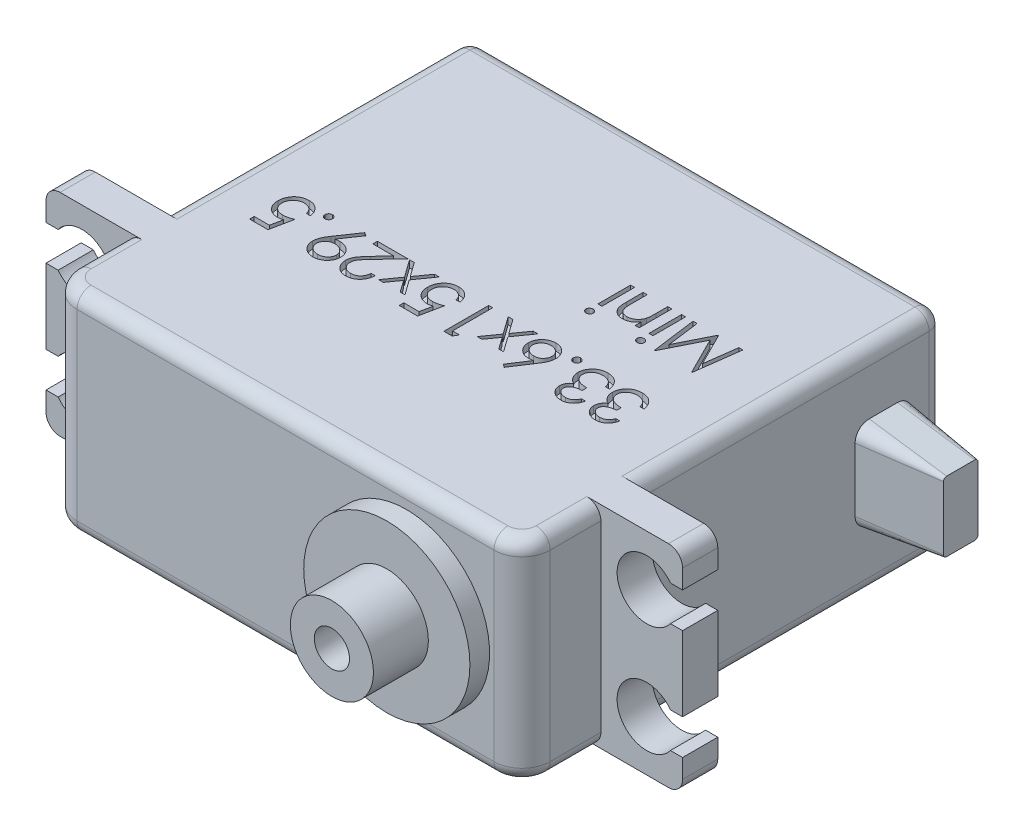
from build123d import *

# Parameters (mm, degrees)
SKETCH1_W                = 33.6
SKETCH1_H                = 15
BOSS_EXTRUDE1_DEPTH      = 14.95
BOSS_EXTRUDE2_DEPTH      = 7.5
BOSS_EXTRUDE2_DEPTH_BACK = 7.5
SKETCH2_W                = 45.2
SKETCH2_H                = 2.5
CUT_EXTRUDE2_DEPTH       = 10
SKETCH3_R                = 2.95
BOSS_EXTRUDE3_DEPTH      = 5.3
SKETCH4_W                = 0.284935897
SKETCH4_H                = 2.320192308
SKETCH4_W_2              = 0.284935898
CUT_EXTRUDE1_DEPTH       = 0.5
SKETCH7_R                = 5.9
BOSS_EXTRUDE4_DEPTH      = 1.4
FILLET1_R                = 2
BOSS_EXTRUDE5_DEPTH      = 5.5
BOSS_EXTRUDE5_TAPER      = 8
FILLET2_R                = 1
FILLET3_R                = 1
SKETCH9_R                = 1.25
CUT_EXTRUDE3_DEPTH       = 3


with BuildPart() as part:
    # Sketch1 → Boss-Extrude1 (new, symmetric)
    with BuildSketch(Plane.XY):
        Rectangle(SKETCH1_W, SKETCH1_H)
    extrude(amount=BOSS_EXTRUDE1_DEPTH, both=True)

    # Sketch2 → Boss-Extrude2 (add, two sides: drawn at the far end of the back side and taken through both)
    with BuildSketch(Plane(origin=(0, 0, 0), x_dir=(1, 0, 0), z_dir=(0, 1, 0)).offset(-BOSS_EXTRUDE2_DEPTH_BACK)):
        with Locations((0, -8.1)):
            Rectangle(SKETCH2_W, SKETCH2_H)
    extrude(amount=BOSS_EXTRUDE2_DEPTH + BOSS_EXTRUDE2_DEPTH_BACK)

    # Sketch6 → Cut-Extrude2 (cut)
    with BuildSketch(Plane.XY.offset(9.35)):
        with BuildLine():
            Line((-22.6, 5.15), (-21.737453703, 5.15))
            ThreePointArc((-21.737453703, 5.15), (-17.95, 3.9), (-21.737453703, 2.65))
            Line((-21.737453703, 2.65), (-22.6, 2.65))
            Line((-22.6, 2.65), (-22.6, 5.15))
        make_face()
        with BuildLine():
            Line((22.6, 2.65), (21.737453703, 2.65))
            ThreePointArc((21.737453703, 2.65), (17.95, 3.9), (21.737453703, 5.15))
            Line((21.737453703, 5.15), (22.6, 5.15))
            Line((22.6, 5.15), (22.6, 2.65))
        make_face()
        with BuildLine():
            Line((22.6, -2.65), (21.737453703, -2.65))
            ThreePointArc((21.737453703, -2.65), (17.95, -3.9), (21.737453703, -5.15))
            Line((21.737453703, -5.15), (22.6, -5.15))
            Line((22.6, -5.15), (22.6, -2.65))
        make_face()
        with BuildLine():
            Line((-22.6, -2.65), (-21.737453703, -2.65))
            ThreePointArc((-21.737453703, -2.65), (-17.95, -3.9), (-21.737453703, -5.15))
            Line((-21.737453703, -5.15), (-22.6, -5.15))
            Line((-22.6, -5.15), (-22.6, -2.65))
        make_face()
    extrude(amount=-CUT_EXTRUDE2_DEPTH, mode=Mode.SUBTRACT)

    # Sketch3 → Boss-Extrude3 (add)
    with BuildSketch(Plane.XY.offset(14.95)):
        with Locations(Location((8.6, 0, 0), (0, 0, 180))):
            Circle(SKETCH3_R)
    extrude(amount=BOSS_EXTRUDE3_DEPTH)

    # Sketch4 → Cut-Extrude1 (cut)
    # profile 1 of 18: a face of its own
    with BuildSketch(Plane.XZ.offset(-7.5)):
        with BuildLine():
            Line((12.047006277, 3.52944053), (12.331942175, 3.52944053))
            add(Edge.make_bspline(
                [(12.331942175, 3.52944053), (12.324222797, 3.561401426), (12.309132044, 3.623882364), (12.277656388, 3.713151808), (12.243367063, 3.797628145), (12.202192661, 3.875729584), (12.157281149, 3.949025731), (12.105825537, 4.015854151), (12.050199789, 4.077914484), (11.98867287, 4.132990064), (11.924149013, 4.182862718), (11.855719037, 4.225385092), (11.784759697, 4.261964859), (11.710779355, 4.292100355), (11.633557757, 4.31480208), (11.553793027, 4.331272896), (11.471276137, 4.341969122), (11.415262252, 4.343013028), (11.386819979, 4.343543094)],
                knots=[0, 0, 0, 0, 1.162005537, 2.271625781, 3.343758855, 4.383309926, 5.390229558, 6.379919256, 7.361854164, 8.333198761, 9.295911338, 10.242430842, 11.177959212, 12.116337295, 13.062827104, 14.020064771, 14.994644689, 16, 16, 16, 16], degree=3))
            add(Edge.make_bspline(
                [(11.386819979, 4.343543094), (11.345379206, 4.342291935), (11.263401603, 4.339816909), (11.142966553, 4.317215956), (11.026827939, 4.281451729), (10.916256978, 4.232036276), (10.813551686, 4.171087785), (10.722169574, 4.098548345), (10.643349282, 4.01581755), (10.577223668, 3.924438724), (10.52544849, 3.826779798), (10.487270137, 3.726268227), (10.464027612, 3.623142438), (10.461015393, 3.553512621), (10.459506277, 3.518628231)],
                knots=[0, 0, 0, 0, 1.083050992, 2.142477498, 3.193116406, 4.255571735, 5.30263384, 6.308962982, 7.297363603, 8.282367274, 9.249857812, 10.179914175, 11.08814088, 12, 12, 12, 12], degree=3))
            add(Edge.make_bspline(
                [(10.459506277, 3.518628231), (10.460561821, 3.485057781), (10.462627355, 3.419365621), (10.480165788, 3.32346112), (10.509680826, 3.233071954), (10.55056554, 3.147817614), (10.60348966, 3.068238652), (10.667599892, 2.994156023), (10.743348735, 2.925241144), (10.800751772, 2.885762764), (10.830304554, 2.865438126)],
                knots=[0, 0, 0, 0, 1.024540389, 2.004866551, 2.965041327, 3.920577974, 4.882998113, 5.874504559, 6.905732034, 8, 8, 8, 8], degree=3))
            add(Edge.make_bspline(
                [(10.830304554, 2.865438126), (10.796530034, 2.849129357), (10.729612941, 2.816816966), (10.638399246, 2.753447815), (10.555597174, 2.680280986), (10.509420229, 2.623183008), (10.486219018, 2.594494617)],
                knots=[0, 0, 0, 0, 1.015518401, 2.012035669, 3.001164323, 4, 4, 4, 4], degree=3))
            add(Edge.make_bspline(
                [(10.486219018, 2.594494617), (10.470941514, 2.573577942), (10.440636687, 2.532087118), (10.403230167, 2.465379074), (10.369294756, 2.397931652), (10.342851343, 2.327937048), (10.322373621, 2.256206528), (10.307735935, 2.182616926), (10.298642607, 2.107108149), (10.297340356, 2.056024684), (10.296685764, 2.030346981)],
                knots=[0, 0, 0, 0, 1.025084078, 2.033381695, 3.024893161, 4.013698104, 4.991890475, 5.976764909, 6.982997093, 8, 8, 8, 8], degree=3))
            add(Edge.make_bspline(
                [(10.296685764, 2.030346981), (10.298313644, 1.985888162), (10.301561744, 1.897179749), (10.330594011, 1.766120537), (10.375600308, 1.638008832), (10.439514814, 1.515476656), (10.517408912, 1.400831596), (10.610080199, 1.29825523), (10.716475726, 1.21008221), (10.835135136, 1.136412932), (10.963692817, 1.077523103), (11.101193533, 1.036649565), (11.245656082, 1.010028551), (11.344722702, 1.007173892), (11.395088208, 1.005722582)],
                knots=[0, 0, 0, 0, 0.955779014, 1.907060117, 2.875433937, 3.871313158, 4.872415639, 5.851225146, 6.836215519, 7.83643374, 8.849228613, 9.86973379, 10.916971861, 12, 12, 12, 12], degree=3))
            add(Edge.make_bspline(
                [(11.395088208, 1.005722582), (11.429032859, 1.006510175), (11.495824613, 1.008059896), (11.59401693, 1.018654056), (11.687744471, 1.038003418), (11.777133963, 1.064041416), (11.862264818, 1.097053925), (11.942877256, 1.138164458), (12.019467231, 1.186525607), (12.091311994, 1.242708218), (12.15840298, 1.305556291), (12.218957237, 1.376185536), (12.273984335, 1.453290324), (12.322010872, 1.537766239), (12.365224393, 1.628521579), (12.400767118, 1.726718431), (12.432050455, 1.831478937), (12.446595098, 1.904483744), (12.454057559, 1.94194053)],
                knots=[0, 0, 0, 0, 1.048658725, 2.063410685, 3.046034179, 4.001477787, 4.936774919, 5.862367409, 6.792675028, 7.730719943, 8.675894397, 9.627829632, 10.600096036, 11.597688215, 12.626045268, 13.701542398, 14.82072376, 16, 16, 16, 16], degree=3))
            Line((12.454057559, 1.94194053), (12.169121662, 1.94194053))
            add(Edge.make_bspline(
                [(12.169121662, 1.94194053), (12.161698247, 1.917493925), (12.147259062, 1.869943155), (12.122680663, 1.801508021), (12.09467873, 1.738771787), (12.064639095, 1.681274241), (12.033090076, 1.628449133), (11.99778868, 1.581693294), (11.961349527, 1.538953075), (11.933881827, 1.51487332), (11.920438769, 1.503088367)],
                knots=[0, 0, 0, 0, 1.198163088, 2.33053128, 3.407730985, 4.417276592, 5.372219308, 6.28897303, 7.162600585, 8, 8, 8, 8], degree=3))
            add(Edge.make_bspline(
                [(11.920438769, 1.503088367), (11.902661875, 1.48938295), (11.867162959, 1.462014421), (11.809316064, 1.427087943), (11.748478631, 1.396824728), (11.683332463, 1.373707375), (11.615283349, 1.354133354), (11.543231382, 1.341324026), (11.467812235, 1.332535471), (11.416315764, 1.331759926), (11.390000067, 1.331363607)],
                knots=[0, 0, 0, 0, 0.946170439, 1.889420265, 2.845303464, 3.807233317, 4.801018734, 5.828864929, 6.890507805, 8, 8, 8, 8], degree=3))
            add(Edge.make_bspline(
                [(11.390000067, 1.331363607), (11.360287961, 1.331922321), (11.302188503, 1.333014838), (11.217411595, 1.343062087), (11.136759839, 1.357694676), (11.061128685, 1.38029431), (10.989527439, 1.40821694), (10.9229598, 1.443276565), (10.860551903, 1.484410705), (10.803103085, 1.531164085), (10.751445375, 1.582346441), (10.705961674, 1.635879727), (10.667295017, 1.69153823), (10.636104199, 1.749629953), (10.611474771, 1.80991434), (10.594707868, 1.872560563), (10.583049708, 1.937055941), (10.582100281, 1.98089722), (10.581621662, 2.002998223)],
                knots=[0, 0, 0, 0, 1.217147791, 2.380027433, 3.494444702, 4.572153297, 5.609568379, 6.639424714, 7.649109417, 8.668170816, 9.669597737, 10.625200337, 11.543417969, 12.441394052, 13.322311151, 14.205496177, 15.095365482, 16, 16, 16, 16], degree=3))
            add(Edge.make_bspline(
                [(10.581621662, 2.002998223), (10.583009864, 2.032581366), (10.585779361, 2.09160045), (10.606923572, 2.178429964), (10.641702399, 2.262089774), (10.690391034, 2.341152526), (10.749659874, 2.414427808), (10.818933753, 2.479806939), (10.898787932, 2.533754807), (10.972284527, 2.571028089), (11.037385777, 2.596461721), (11.093098304, 2.613402582), (11.155470366, 2.627747826), (11.223747696, 2.641093958), (11.298444757, 2.65245261), (11.379480226, 2.661924829), (11.466870524, 2.669504044), (11.527368938, 2.672888681), (11.558544739, 2.674632838)],
                knots=[0, 0, 0, 0, 1.07054697, 2.135767047, 3.216561865, 4.33974944, 5.486079747, 6.621378074, 7.775625952, 8.963672916, 9.598146892, 10.304877434, 11.070270905, 11.915000392, 12.823868403, 13.805723172, 14.86925407, 16, 16, 16, 16], degree=3))
            Line((11.558544739, 2.674632838), (11.558544739, 3.000273864))
            add(Edge.make_bspline(
                [(11.558544739, 3.000273864), (11.519264396, 3.000940436), (11.442323853, 3.002246086), (11.329934019, 3.018037639), (11.2224618, 3.039882208), (11.12228897, 3.073342347), (11.030986208, 3.112204616), (10.951774855, 3.157427692), (10.885764657, 3.207696786), (10.8332764, 3.263787796), (10.793789171, 3.323945018), (10.764917719, 3.3866437), (10.747863137, 3.452433384), (10.745586511, 3.497332118), (10.744442175, 3.519900266)],
                knots=[0, 0, 0, 0, 1.321986639, 2.589447074, 3.816329219, 5.01088745, 6.139805852, 7.153945165, 8.075214402, 8.924034688, 9.728124013, 10.488707548, 11.240355623, 12, 12, 12, 12], degree=3))
            add(Edge.make_bspline(
                [(10.744442175, 3.519900266), (10.744818105, 3.536480792), (10.745565999, 3.569466962), (10.754997816, 3.617658988), (10.769171053, 3.664377704), (10.788656236, 3.709424431), (10.814736773, 3.752486751), (10.845947918, 3.793931794), (10.883111838, 3.833522937), (10.925698065, 3.870425798), (10.971428773, 3.905595035), (11.021548212, 3.935452405), (11.074545199, 3.960983997), (11.130478407, 3.982038331), (11.189529352, 3.9978764), (11.251420587, 4.009248199), (11.316270128, 4.016358071), (11.360513056, 4.017381706), (11.383003873, 4.017902069)],
                knots=[0, 0, 0, 0, 0.884392785, 1.759457502, 2.611959086, 3.489218968, 4.37281399, 5.2945488, 6.255912374, 7.266815255, 8.301784654, 9.332968512, 10.37626691, 11.440494194, 12.520033166, 13.637162961, 14.798855837, 16, 16, 16, 16], degree=3))
            add(Edge.make_bspline(
                [(11.383003873, 4.017902069), (11.419155029, 4.016639905), (11.489766645, 4.014174605), (11.591561605, 3.992581871), (11.686194144, 3.958130324), (11.758528506, 3.917006799), (11.811943412, 3.876411763), (11.850113206, 3.840958455), (11.887596812, 3.801558679), (11.921928248, 3.755785724), (11.956648212, 3.706739422), (11.988257207, 3.651926511), (12.018972785, 3.59277681), (12.037480812, 3.550961485), (12.047006277, 3.52944053)],
                knots=[0, 0, 0, 0, 1.472543308, 2.876219568, 4.221790263, 5.565193594, 6.249813518, 6.953379497, 7.687249741, 8.463570142, 9.283606569, 10.136032583, 11.040678096, 12, 12, 12, 12], degree=3))
        make_face()
    # profile 2 of 18: a face of its own
    with BuildSketch(Plane.XZ.offset(-7.5)):
        with BuildLine():
            Line((9.604698585, 3.52944053), (9.889634482, 3.52944053))
            add(Edge.make_bspline(
                [(9.889634482, 3.52944053), (9.881915104, 3.561401426), (9.866824351, 3.623882364), (9.835348695, 3.713151808), (9.801059371, 3.797628145), (9.759884969, 3.875729584), (9.714973456, 3.949025731), (9.663517845, 4.015854151), (9.607892096, 4.077914484), (9.546365178, 4.132990064), (9.481841321, 4.182862718), (9.413411344, 4.225385092), (9.342452005, 4.261964859), (9.268471663, 4.292100355), (9.191250064, 4.31480208), (9.111485335, 4.331272896), (9.028968445, 4.341969122), (8.972954559, 4.343013028), (8.944512287, 4.343543094)],
                knots=[0, 0, 0, 0, 1.162005537, 2.271625781, 3.343758855, 4.383309926, 5.390229558, 6.379919256, 7.361854164, 8.333198761, 9.295911338, 10.242430842, 11.177959212, 12.116337295, 13.062827104, 14.020064771, 14.994644689, 16, 16, 16, 16], degree=3))
            add(Edge.make_bspline(
                [(8.944512287, 4.343543094), (8.903071514, 4.342291935), (8.821093911, 4.339816909), (8.700658861, 4.317215956), (8.584520247, 4.281451729), (8.473949286, 4.232036276), (8.371243994, 4.171087785), (8.279861881, 4.098548345), (8.20104159, 4.01581755), (8.134915975, 3.924438724), (8.083140798, 3.826779798), (8.044962445, 3.726268227), (8.02171992, 3.623142438), (8.0187077, 3.553512621), (8.017198585, 3.518628231)],
                knots=[0, 0, 0, 0, 1.083050992, 2.142477498, 3.193116406, 4.255571735, 5.30263384, 6.308962982, 7.297363603, 8.282367274, 9.249857812, 10.179914175, 11.08814088, 12, 12, 12, 12], degree=3))
            add(Edge.make_bspline(
                [(8.017198585, 3.518628231), (8.018254128, 3.485057781), (8.020319663, 3.419365621), (8.037858096, 3.32346112), (8.067373134, 3.233071954), (8.108257847, 3.147817614), (8.161181968, 3.068238652), (8.2252922, 2.994156023), (8.301041043, 2.925241144), (8.35844408, 2.885762764), (8.387996862, 2.865438126)],
                knots=[0, 0, 0, 0, 1.024540389, 2.004866551, 2.965041327, 3.920577974, 4.882998113, 5.874504559, 6.905732034, 8, 8, 8, 8], degree=3))
            add(Edge.make_bspline(
                [(8.387996862, 2.865438126), (8.354222342, 2.849129357), (8.287305249, 2.816816966), (8.196091554, 2.753447815), (8.113289482, 2.680280986), (8.067112536, 2.623183008), (8.043911325, 2.594494617)],
                knots=[0, 0, 0, 0, 1.015518401, 2.012035669, 3.001164323, 4, 4, 4, 4], degree=3))
            add(Edge.make_bspline(
                [(8.043911325, 2.594494617), (8.028633822, 2.573577942), (7.998328995, 2.532087118), (7.960922475, 2.465379074), (7.926987064, 2.397931652), (7.900543651, 2.327937048), (7.880065929, 2.256206528), (7.865428242, 2.182616926), (7.856334914, 2.107108149), (7.855032664, 2.056024684), (7.854378072, 2.030346981)],
                knots=[0, 0, 0, 0, 1.025084078, 2.033381695, 3.024893161, 4.013698104, 4.991890475, 5.976764909, 6.982997093, 8, 8, 8, 8], degree=3))
            add(Edge.make_bspline(
                [(7.854378072, 2.030346981), (7.856005952, 1.985888162), (7.859254052, 1.897179749), (7.888286319, 1.766120537), (7.933292616, 1.638008832), (7.997207122, 1.515476656), (8.075101219, 1.400831596), (8.167772506, 1.29825523), (8.274168034, 1.21008221), (8.392827444, 1.136412932), (8.521385125, 1.077523103), (8.65888584, 1.036649565), (8.803348389, 1.010028551), (8.902415009, 1.007173892), (8.952780516, 1.005722582)],
                knots=[0, 0, 0, 0, 0.955779014, 1.907060117, 2.875433937, 3.871313158, 4.872415639, 5.851225146, 6.836215519, 7.83643374, 8.849228613, 9.86973379, 10.916971861, 12, 12, 12, 12], degree=3))
            add(Edge.make_bspline(
                [(8.952780516, 1.005722582), (8.986725167, 1.006510175), (9.053516921, 1.008059896), (9.151709237, 1.018654056), (9.245436779, 1.038003418), (9.334826271, 1.064041416), (9.419957126, 1.097053925), (9.500569564, 1.138164458), (9.577159539, 1.186525607), (9.649004302, 1.242708218), (9.716095288, 1.305556291), (9.776649545, 1.376185536), (9.831676643, 1.453290324), (9.879703179, 1.537766239), (9.922916701, 1.628521579), (9.958459426, 1.726718431), (9.989742763, 1.831478937), (10.004287405, 1.904483744), (10.011749867, 1.94194053)],
                knots=[0, 0, 0, 0, 1.048658725, 2.063410685, 3.046034179, 4.001477787, 4.936774919, 5.862367409, 6.792675028, 7.730719943, 8.675894397, 9.627829632, 10.600096036, 11.597688215, 12.626045268, 13.701542398, 14.82072376, 16, 16, 16, 16], degree=3))
            Line((10.011749867, 1.94194053), (9.72681397, 1.94194053))
            add(Edge.make_bspline(
                [(9.72681397, 1.94194053), (9.719390555, 1.917493925), (9.704951369, 1.869943155), (9.68037297, 1.801508021), (9.652371038, 1.738771787), (9.622331403, 1.681274241), (9.590782384, 1.628449133), (9.555480987, 1.581693294), (9.519041834, 1.538953075), (9.491574135, 1.51487332), (9.478131077, 1.503088367)],
                knots=[0, 0, 0, 0, 1.198163088, 2.33053128, 3.407730985, 4.417276592, 5.372219308, 6.28897303, 7.162600585, 8, 8, 8, 8], degree=3))
            add(Edge.make_bspline(
                [(9.478131077, 1.503088367), (9.460354182, 1.48938295), (9.424855267, 1.462014421), (9.367008371, 1.427087943), (9.306170939, 1.396824728), (9.24102477, 1.373707375), (9.172975657, 1.354133354), (9.10092369, 1.341324026), (9.025504543, 1.332535471), (8.974008072, 1.331759926), (8.947692375, 1.331363607)],
                knots=[0, 0, 0, 0, 0.946170439, 1.889420265, 2.845303464, 3.807233317, 4.801018734, 5.828864929, 6.890507805, 8, 8, 8, 8], degree=3))
            add(Edge.make_bspline(
                [(8.947692375, 1.331363607), (8.917980269, 1.331922321), (8.859880811, 1.333014838), (8.775103903, 1.343062087), (8.694452147, 1.357694676), (8.618820992, 1.38029431), (8.547219747, 1.40821694), (8.480652107, 1.443276565), (8.418244211, 1.484410705), (8.360795393, 1.531164085), (8.309137683, 1.582346441), (8.263653981, 1.635879727), (8.224987324, 1.69153823), (8.193796507, 1.749629953), (8.169167079, 1.80991434), (8.152400176, 1.872560563), (8.140742016, 1.937055941), (8.139792589, 1.98089722), (8.13931397, 2.002998223)],
                knots=[0, 0, 0, 0, 1.217147791, 2.380027433, 3.494444702, 4.572153297, 5.609568379, 6.639424714, 7.649109417, 8.668170816, 9.669597737, 10.625200337, 11.543417969, 12.441394052, 13.322311151, 14.205496177, 15.095365482, 16, 16, 16, 16], degree=3))
            add(Edge.make_bspline(
                [(8.13931397, 2.002998223), (8.140702172, 2.032581366), (8.143471668, 2.09160045), (8.16461588, 2.178429964), (8.199394706, 2.262089774), (8.248083342, 2.341152526), (8.307352181, 2.414427808), (8.376626061, 2.479806939), (8.45648024, 2.533754807), (8.529976835, 2.571028089), (8.595078084, 2.596461721), (8.650790612, 2.613402582), (8.713162673, 2.627747826), (8.781440004, 2.641093958), (8.856137065, 2.65245261), (8.937172533, 2.661924829), (9.024562831, 2.669504044), (9.085061246, 2.672888681), (9.116237046, 2.674632838)],
                knots=[0, 0, 0, 0, 1.07054697, 2.135767047, 3.216561865, 4.33974944, 5.486079747, 6.621378074, 7.775625952, 8.963672916, 9.598146892, 10.304877434, 11.070270905, 11.915000392, 12.823868403, 13.805723172, 14.86925407, 16, 16, 16, 16], degree=3))
            Line((9.116237046, 2.674632838), (9.116237046, 3.000273864))
            add(Edge.make_bspline(
                [(9.116237046, 3.000273864), (9.076956703, 3.000940436), (9.00001616, 3.002246086), (8.887626327, 3.018037639), (8.780154108, 3.039882208), (8.679981278, 3.073342347), (8.588678516, 3.112204616), (8.509467163, 3.157427692), (8.443456965, 3.207696786), (8.390968707, 3.263787796), (8.351481478, 3.323945018), (8.322610026, 3.3866437), (8.305555445, 3.452433384), (8.303278818, 3.497332118), (8.302134482, 3.519900266)],
                knots=[0, 0, 0, 0, 1.321986639, 2.589447074, 3.816329219, 5.01088745, 6.139805852, 7.153945165, 8.075214402, 8.924034688, 9.728124013, 10.488707548, 11.240355623, 12, 12, 12, 12], degree=3))
            add(Edge.make_bspline(
                [(8.302134482, 3.519900266), (8.302510412, 3.536480792), (8.303258307, 3.569466962), (8.312690123, 3.617658988), (8.326863361, 3.664377704), (8.346348544, 3.709424431), (8.372429081, 3.752486751), (8.403640226, 3.793931794), (8.440804145, 3.833522937), (8.483390372, 3.870425798), (8.529121081, 3.905595035), (8.57924052, 3.935452405), (8.632237506, 3.960983997), (8.688170715, 3.982038331), (8.74722166, 3.9978764), (8.809112894, 4.009248199), (8.873962436, 4.016358071), (8.918205364, 4.017381706), (8.940696181, 4.017902069)],
                knots=[0, 0, 0, 0, 0.884392785, 1.759457502, 2.611959086, 3.489218968, 4.37281399, 5.2945488, 6.255912374, 7.266815255, 8.301784654, 9.332968512, 10.37626691, 11.440494194, 12.520033166, 13.637162961, 14.798855837, 16, 16, 16, 16], degree=3))
            add(Edge.make_bspline(
                [(8.940696181, 4.017902069), (8.976847337, 4.016639905), (9.047458953, 4.014174605), (9.149253913, 3.992581871), (9.243886452, 3.958130324), (9.316220814, 3.917006799), (9.36963572, 3.876411763), (9.407805514, 3.840958455), (9.44528912, 3.801558679), (9.479620555, 3.755785724), (9.51434052, 3.706739422), (9.545949515, 3.651926511), (9.576665093, 3.59277681), (9.59517312, 3.550961485), (9.604698585, 3.52944053)],
                knots=[0, 0, 0, 0, 1.472543308, 2.876219568, 4.221790263, 5.565193594, 6.249813518, 6.953379497, 7.687249741, 8.463570142, 9.283606569, 10.136032583, 11.040678096, 12, 12, 12, 12], degree=3))
        make_face()
    # profile 3 of 18: a face of its own
    with BuildSketch(Plane.XZ.offset(-7.5)):
        with BuildLine():
            add(Edge.make_bspline(
                [(7.060628072, 1.575594376), (7.042947665, 1.574543754), (7.008287295, 1.572484131), (6.958177514, 1.558353863), (6.912825216, 1.533263506), (6.872428108, 1.4998237), (6.83913009, 1.459278349), (6.813145571, 1.414287774), (6.799138391, 1.363758472), (6.797093771, 1.328897267), (6.796044739, 1.311011043)],
                knots=[0, 0, 0, 0, 1.020151414, 1.999887582, 2.974338812, 3.990962822, 5.007586832, 5.987933904, 6.967670073, 8, 8, 8, 8], degree=3))
            add(Edge.make_bspline(
                [(6.796044739, 1.311011043), (6.797129319, 1.293554594), (6.799268097, 1.259130733), (6.813113463, 1.208982549), (6.839328122, 1.163963857), (6.872198437, 1.122868346), (6.912835202, 1.089357699), (6.958284734, 1.064480808), (7.008169661, 1.049338797), (7.04292804, 1.047409942), (7.060628072, 1.04642771)],
                knots=[0, 0, 0, 0, 1.009421747, 1.99056486, 2.972319754, 3.999869655, 5.017953583, 5.993804169, 6.978383603, 8, 8, 8, 8], degree=3))
            add(Edge.make_bspline(
                [(7.060628072, 1.04642771), (7.078340858, 1.047374401), (7.112920856, 1.049222592), (7.162619579, 1.064791709), (7.208345901, 1.089124419), (7.248974753, 1.12293083), (7.282120367, 1.163752389), (7.307180536, 1.20929259), (7.322230171, 1.258987179), (7.324209441, 1.29352632), (7.325211405, 1.311011043)],
                knots=[0, 0, 0, 0, 1.022052826, 1.995314843, 2.982371812, 4.00089066, 5.028879526, 6.005146991, 6.990147033, 8, 8, 8, 8], degree=3))
            add(Edge.make_bspline(
                [(7.325211405, 1.311011043), (7.32424793, 1.328926552), (7.322366861, 1.363904384), (7.307148941, 1.41397786), (7.282314806, 1.459487801), (7.248745626, 1.499761842), (7.208355729, 1.533496038), (7.162729886, 1.558047671), (7.11280116, 1.572598617), (7.078320716, 1.574578471), (7.060628072, 1.575594376)],
                knots=[0, 0, 0, 0, 1.032775665, 2.016367738, 2.991239715, 4.008302682, 5.025365648, 6.011011707, 6.979408107, 8, 8, 8, 8], degree=3))
        make_face()
    # profile 4 of 18: a face of its own
    with BuildSketch(Plane.XZ.offset(-7.5)):
        with BuildLine():
            Line((4.923608841, 4.343543094), (4.70418276, 4.171182317))
            Line((4.70418276, 4.171182317), (5.543090011, 2.888334761))
            add(Edge.make_bspline(
                [(5.543090011, 2.888334761), (5.487236974, 2.897237335), (5.37828931, 2.914602811), (5.268011674, 2.917467519), (5.214268897, 2.918863607)],
                knots=[0, 0, 0, 0, 1.025318673, 2, 2, 2, 2], degree=3))
            add(Edge.make_bspline(
                [(5.214268897, 2.918863607), (5.181999561, 2.917996277), (5.118478334, 2.916288964), (5.025217878, 2.903150042), (4.9356022, 2.882444405), (4.850002737, 2.852261716), (4.768112247, 2.813706009), (4.689460787, 2.767497176), (4.615526821, 2.711249166), (4.545358251, 2.648415957), (4.481652242, 2.578822692), (4.425249677, 2.504980051), (4.377872516, 2.426964966), (4.339433316, 2.344816952), (4.30958389, 2.258662638), (4.287823669, 2.168612254), (4.274960753, 2.074603705), (4.273214058, 2.010669932), (4.27232679, 1.978193535)],
                knots=[0, 0, 0, 0, 1.04369286, 2.054478336, 3.041073146, 4.015093852, 4.984733326, 5.965804835, 6.960378782, 7.985147595, 9.009457201, 10.008161701, 10.986880575, 11.956520048, 12.937015923, 13.931873656, 14.949455224, 16, 16, 16, 16], degree=3))
            add(Edge.make_bspline(
                [(4.27232679, 1.978193535), (4.273617749, 1.933761946), (4.276158052, 1.846331095), (4.301470781, 1.718989369), (4.340804173, 1.597674872), (4.397026646, 1.484324496), (4.466860664, 1.379093593), (4.552021052, 1.285852492), (4.649487645, 1.202694673), (4.759693526, 1.133156168), (4.878296072, 1.076366258), (5.002893956, 1.03557636), (5.132277153, 1.010463498), (5.220092761, 1.007315166), (5.26451429, 1.005722582)],
                knots=[0, 0, 0, 0, 1.031375318, 2.029502543, 3.004789286, 3.987476834, 4.960371455, 5.9300674, 6.912260825, 7.929083631, 8.949397511, 9.960523116, 10.96833055, 12, 12, 12, 12], degree=3))
            add(Edge.make_bspline(
                [(5.26451429, 1.005722582), (5.307237726, 1.007108882), (5.391865371, 1.009854902), (5.51635512, 1.03431686), (5.635973715, 1.073965446), (5.749883082, 1.128588399), (5.855402495, 1.197583764), (5.949804893, 1.280643831), (6.032619575, 1.375993132), (6.101539409, 1.483616875), (6.156202688, 1.59926848), (6.197196405, 1.719861472), (6.221141569, 1.844956455), (6.224487617, 1.929757203), (6.226172944, 1.972469376)],
                knots=[0, 0, 0, 0, 1.012016664, 2.004627821, 2.994792927, 3.992885782, 4.990978636, 5.973936114, 6.964471063, 7.975201453, 8.993600317, 9.990122807, 10.98767138, 12, 12, 12, 12], degree=3))
            add(Edge.make_bspline(
                [(6.226172944, 1.972469376), (6.225101204, 2.005166963), (6.222912917, 2.071929186), (6.207633556, 2.173042983), (6.183081921, 2.276503607), (6.155586197, 2.364273483), (6.126534394, 2.436175006), (6.102356733, 2.494144601), (6.07226318, 2.553799289), (6.040174469, 2.617184659), (6.003202167, 2.682667159), (5.963001542, 2.751341202), (5.918461145, 2.822114607), (5.88723714, 2.870142556), (5.871275107, 2.894694937)],
                knots=[0, 0, 0, 0, 1.173818275, 2.396712641, 3.66331629, 4.989737886, 5.693666774, 6.447286557, 7.243889047, 8.091586357, 8.998013824, 9.943181721, 10.948533338, 12, 12, 12, 12], degree=3))
            Line((5.871275107, 2.894694937), (4.923608841, 4.343543094))
        make_face()
        with BuildLine():
            add(Edge.make_bspline(
                [(5.274054554, 2.593222582), (5.298241019, 2.592516785), (5.345484211, 2.591138159), (5.414796652, 2.583132394), (5.480395102, 2.568056528), (5.543148644, 2.548855641), (5.60188406, 2.522455008), (5.657028222, 2.490385876), (5.708794376, 2.452629522), (5.756640313, 2.409720838), (5.800019579, 2.362741694), (5.837376747, 2.312422913), (5.869600639, 2.259977172), (5.895800575, 2.204966267), (5.916202286, 2.147411228), (5.930959914, 2.087576766), (5.939172959, 2.025061646), (5.940539327, 1.98266859), (5.941237046, 1.961021059)],
                knots=[0, 0, 0, 0, 1.129588631, 2.206414736, 3.251139165, 4.268635594, 5.265702196, 6.250456724, 7.242448911, 8.251968645, 9.246821453, 10.222880186, 11.173611482, 12.116736599, 13.062300278, 14.020270554, 14.989073742, 16, 16, 16, 16], degree=3))
            add(Edge.make_bspline(
                [(5.941237046, 1.961021059), (5.940668847, 1.939567149), (5.939554693, 1.897499225), (5.929437945, 1.835505826), (5.913984692, 1.775847659), (5.890997333, 1.71883228), (5.863577227, 1.66359062), (5.827377398, 1.612123611), (5.787266456, 1.561305405), (5.739320388, 1.515039784), (5.687864194, 1.471989847), (5.632890246, 1.434361331), (5.57559514, 1.402170302), (5.51520535, 1.376941664), (5.452577673, 1.356236775), (5.387190313, 1.341666719), (5.318997794, 1.333429384), (5.272804322, 1.332061237), (5.249249867, 1.331363607)],
                knots=[0, 0, 0, 0, 0.989467248, 1.94019797, 2.891935182, 3.827694429, 4.772920941, 5.730924762, 6.725747692, 7.756678648, 8.79901574, 9.819492441, 10.826891316, 11.826466727, 12.835195252, 13.867842842, 14.912794438, 16, 16, 16, 16], degree=3))
            add(Edge.make_bspline(
                [(5.249249867, 1.331363607), (5.22569545, 1.332061292), (5.179502054, 1.333429546), (5.111308986, 1.341666103), (5.045923654, 1.356239034), (4.983288607, 1.376933475), (4.922926023, 1.402200678), (4.865681026, 1.434161063), (4.81122697, 1.472221255), (4.759736997, 1.514966215), (4.711990496, 1.561568731), (4.670917536, 1.611669979), (4.635826317, 1.664006584), (4.607311019, 1.71861467), (4.584576848, 1.775882134), (4.569045231, 1.83549659), (4.558949376, 1.897501642), (4.557832351, 1.939567965), (4.557262687, 1.961021059)],
                knots=[0, 0, 0, 0, 1.087397944, 2.132534446, 3.165364764, 4.174271784, 5.174024072, 6.181601208, 7.194203697, 8.236725232, 9.267838612, 10.269026844, 11.221737037, 12.171628256, 13.107553087, 14.05945871, 15.010357665, 16, 16, 16, 16], degree=3))
            add(Edge.make_bspline(
                [(4.557262687, 1.961021059), (4.557761882, 1.98269683), (4.558741638, 2.02523932), (4.569823248, 2.087548802), (4.585192402, 2.147715239), (4.608399865, 2.205360493), (4.63855016, 2.260257084), (4.675274393, 2.312682322), (4.717758225, 2.363038137), (4.766832421, 2.40981297), (4.820254277, 2.452582105), (4.877055558, 2.490336989), (4.936480648, 2.52220036), (4.998469296, 2.548786089), (5.063731768, 2.567971683), (5.131214433, 2.583078554), (5.201780389, 2.59111767), (5.249656312, 2.592512007), (5.274054554, 2.593222582)],
                knots=[0, 0, 0, 0, 0.978206639, 1.919901502, 2.851605144, 3.780102724, 4.718870031, 5.675451981, 6.667674623, 7.690630536, 8.733308323, 9.756129687, 10.767539656, 11.776269907, 12.797430371, 13.836405707, 14.897401972, 16, 16, 16, 16], degree=3))
        make_face(mode=Mode.SUBTRACT)
    # profile 5 of 18: a face of its own
    with BuildSketch(Plane.XZ.offset(-7.5)):
        Polygon((3.946685764, 3.407325146), (3.607688369, 3.407325146), (3.010467816, 2.570325947), (2.413247263, 3.407325146), (2.074249867, 3.407325146), (2.840651109, 2.333091372), (1.952134482, 1.087132838), (2.291131878, 1.087132838), (3.010467816, 2.095220779), (3.729803753, 1.087132838), (4.068801149, 1.087132838), (3.179648505, 2.333091372), align=None)
    # profile 6 of 18: a face of its own
    with BuildSketch(Plane.XZ.offset(-7.5)):
        Polygon((1.155204394, 4.262132838), (0.568160123, 4.262132838), (0.568160123, 1.087132838), (0.853096021, 1.087132838), (0.853096021, 3.936491812), (1.341557559, 3.936491812), align=None)
    # profile 7 of 18: a face of its own
    with BuildSketch(Plane.XZ.offset(-7.5)):
        with BuildLine():
            Line((-2.606839877, 4.262132838), (-2.606839877, 3.936491812))
            Line((-2.606839877, 3.936491812), (-1.526881944, 3.936491812))
            Line((-1.526881944, 3.936491812), (-1.355793202, 3.101400666))
            add(Edge.make_bspline(
                [(-1.355793202, 3.101400666), (-1.389408174, 3.110680984), (-1.454531865, 3.128660133), (-1.550652596, 3.14862251), (-1.641904095, 3.160656163), (-1.701118181, 3.16229928), (-1.729771567, 3.163094376)],
                knots=[0, 0, 0, 0, 1.100273476, 2.13160584, 3.095893838, 4, 4, 4, 4], degree=3))
            add(Edge.make_bspline(
                [(-1.729771567, 3.163094376), (-1.765226103, 3.162326992), (-1.834938577, 3.160818122), (-1.936936765, 3.146329373), (-2.034303032, 3.123523879), (-2.126833754, 3.091664549), (-2.214700111, 3.050925005), (-2.297093684, 3.000034345), (-2.37525122, 2.940586252), (-2.447770573, 2.872237562), (-2.513560481, 2.79701581), (-2.571405343, 2.716136884), (-2.62053855, 2.63038679), (-2.660054377, 2.538946238), (-2.691608738, 2.442826149), (-2.712610905, 2.341015163), (-2.726596062, 2.23447294), (-2.728158512, 2.161625223), (-2.728955261, 2.12447759)],
                knots=[0, 0, 0, 0, 1.052922333, 2.070308379, 3.05430497, 4.020497103, 4.973039431, 5.925935799, 6.892292201, 7.88610001, 8.88166317, 9.857072816, 10.836096531, 11.812156883, 12.81219415, 13.836441305, 14.89672472, 16, 16, 16, 16], degree=3))
            add(Edge.make_bspline(
                [(-2.728955261, 2.12447759), (-2.728351943, 2.098603861), (-2.72715346, 2.047206065), (-2.721058741, 1.970875255), (-2.709324199, 1.896160399), (-2.693569192, 1.823051586), (-2.673119998, 1.751687227), (-2.648364928, 1.681863055), (-2.61806996, 1.614013662), (-2.58484007, 1.547497054), (-2.547423622, 1.483816979), (-2.505895976, 1.42426397), (-2.462021566, 1.367944658), (-2.414812595, 1.315463057), (-2.363830264, 1.267164034), (-2.309692008, 1.22276095), (-2.252829827, 1.181502886), (-2.192364, 1.145064595), (-2.129641891, 1.111533913), (-2.063757722, 1.084026133), (-1.99621123, 1.059433011), (-1.926030235, 1.039830082), (-1.853373705, 1.024469836), (-1.778121873, 1.014037148), (-1.700669408, 1.006438523), (-1.648168504, 1.005962856), (-1.621648571, 1.005722582)],
                knots=[0, 0, 0, 0, 1.056347294, 2.098418968, 3.122841568, 4.141288669, 5.149314143, 6.15115421, 7.162517403, 8.180376062, 9.185164535, 10.17417709, 11.141909838, 12.097768115, 13.052685741, 14.0056014, 14.954263652, 15.917497458, 16.885230207, 17.854509472, 18.828990115, 19.81800267, 20.826176721, 21.857883937, 22.917946725, 24, 24, 24, 24], degree=3))
            add(Edge.make_bspline(
                [(-1.621648571, 1.005722582), (-1.590012707, 1.00634927), (-1.527772882, 1.007582206), (-1.436586367, 1.020480404), (-1.348852403, 1.038953385), (-1.26527724, 1.066744858), (-1.18511188, 1.101567619), (-1.109435557, 1.145578717), (-1.036314603, 1.195452618), (-0.968721541, 1.254308367), (-0.905987067, 1.318639021), (-0.849829019, 1.388450596), (-0.799814989, 1.462590875), (-0.75674589, 1.541419915), (-0.720008399, 1.624730583), (-0.69114766, 1.712835019), (-0.667853724, 1.80527288), (-0.657999049, 1.868912136), (-0.652993723, 1.901235402)],
                knots=[0, 0, 0, 0, 1.0467383, 2.05933395, 3.04377827, 4.011590433, 4.970194871, 5.932262533, 6.905835911, 7.896367577, 8.894135286, 9.877477877, 10.858688626, 11.851381753, 12.8477658, 13.868841284, 14.917554742, 16, 16, 16, 16], degree=3))
            Line((-0.652993723, 1.901235402), (-0.93792962, 1.901235402))
            add(Edge.make_bspline(
                [(-0.93792962, 1.901235402), (-0.944940526, 1.870958192), (-0.958415876, 1.812763712), (-0.987993948, 1.731001709), (-1.024157992, 1.658140699), (-1.067160508, 1.593216863), (-1.118459464, 1.536602987), (-1.176996875, 1.486150367), (-1.242626595, 1.440634356), (-1.315554739, 1.402695132), (-1.392492318, 1.370338477), (-1.473016859, 1.348792297), (-1.554935802, 1.333642201), (-1.610342609, 1.332125675), (-1.638185029, 1.331363607)],
                knots=[0, 0, 0, 0, 1.136247022, 2.183929868, 3.172523383, 4.106158343, 5.02341133, 5.958108904, 6.928429099, 7.938127109, 8.96079061, 9.975095812, 10.982467395, 12, 12, 12, 12], degree=3))
            add(Edge.make_bspline(
                [(-1.638185029, 1.331363607), (-1.665361618, 1.33210817), (-1.718872544, 1.33357422), (-1.797622873, 1.344858181), (-1.873653123, 1.362236835), (-1.946213082, 1.388244489), (-2.016572479, 1.419853627), (-2.082951542, 1.460416588), (-2.147270581, 1.507098177), (-2.207530388, 1.560580262), (-2.262720459, 1.619517057), (-2.311484941, 1.682542978), (-2.352103998, 1.749777546), (-2.386334225, 1.820056763), (-2.412326861, 1.894150883), (-2.430869751, 1.971712663), (-2.44175824, 2.052933681), (-2.443256096, 2.108332269), (-2.444019364, 2.136561924)],
                knots=[0, 0, 0, 0, 1.027316725, 2.022795036, 3.002884548, 3.971462791, 4.93288096, 5.914575861, 6.907176829, 7.935150275, 8.956128384, 9.956726525, 10.942570165, 11.921478529, 12.907843606, 13.90538589, 14.932640048, 16, 16, 16, 16], degree=3))
            add(Edge.make_bspline(
                [(-2.444019364, 2.136561924), (-2.443422029, 2.162030642), (-2.442252831, 2.211882033), (-2.432700099, 2.284815599), (-2.416083988, 2.353824716), (-2.393020897, 2.419242628), (-2.363738773, 2.481131036), (-2.327955332, 2.539553812), (-2.284999035, 2.593740932), (-2.235929965, 2.643717749), (-2.182174456, 2.689841314), (-2.122807633, 2.729160592), (-2.059071842, 2.762238575), (-1.991734991, 2.790784545), (-1.919195405, 2.81128665), (-1.842889602, 2.826678946), (-1.761993589, 2.835582882), (-1.706684464, 2.836818309), (-1.678254139, 2.837453351)],
                knots=[0, 0, 0, 0, 1.045622112, 2.046656509, 3.013763289, 3.955457236, 4.890082067, 5.820317437, 6.762574623, 7.722996705, 8.69280354, 9.665887285, 10.63943826, 11.638615906, 12.663482002, 13.728887084, 14.832589034, 16, 16, 16, 16], degree=3))
            add(Edge.make_bspline(
                [(-1.678254139, 2.837453351), (-1.653644325, 2.836926672), (-1.602831303, 2.835839213), (-1.524887025, 2.827832319), (-1.442979533, 2.814915245), (-1.357422812, 2.797147721), (-1.267959923, 2.773896672), (-1.174779659, 2.746034233), (-1.077686103, 2.712722134), (-1.012265024, 2.687565054), (-0.978634748, 2.674632838)],
                knots=[0, 0, 0, 0, 0.817624296, 1.688186739, 2.600797293, 3.572016777, 4.590301741, 5.671205678, 6.80286297, 8, 8, 8, 8], degree=3))
            Line((-0.978634748, 2.674632838), (-1.304275774, 4.262132838))
            Line((-1.304275774, 4.262132838), (-2.606839877, 4.262132838))
        make_face()
    # profile 8 of 18: a face of its own
    with BuildSketch(Plane.XZ.offset(-7.5)):
        Polygon((-3.054596287, 3.407325146), (-3.393593683, 3.407325146), (-3.990814236, 2.570325947), (-4.588034789, 3.407325146), (-4.927032184, 3.407325146), (-4.160630942, 2.333091372), (-5.049147569, 1.087132838), (-4.710150173, 1.087132838), (-3.990814236, 2.095220779), (-3.271478298, 1.087132838), (-2.932480902, 1.087132838), (-3.821633547, 2.333091372), align=None)
    # profile 9 of 18: a face of its own
    with BuildSketch(Plane.XZ.offset(-7.5)):
        with BuildLine():
            Line((-5.578314236, 3.285209761), (-5.293378338, 3.285209761))
            add(Edge.make_bspline(
                [(-5.293378338, 3.285209761), (-5.295235398, 3.323011209), (-5.298882615, 3.397252247), (-5.315962563, 3.505496077), (-5.340401788, 3.608960073), (-5.374956178, 3.706813495), (-5.41786973, 3.799921556), (-5.469331969, 3.887914427), (-5.530286391, 3.970456434), (-5.599416785, 4.046782385), (-5.674499765, 4.116802538), (-5.75551301, 4.177268366), (-5.840643856, 4.228356539), (-5.929634025, 4.271065951), (-6.023487537, 4.30312424), (-6.1213527, 4.326911013), (-6.223659488, 4.341222412), (-6.293364366, 4.342760732), (-6.328815037, 4.343543094)],
                knots=[0, 0, 0, 0, 1.10065271, 2.161652631, 3.183658789, 4.190468796, 5.17591951, 6.163126047, 7.15150782, 8.156236427, 9.156009102, 10.134482811, 11.092018607, 12.041330605, 13.001268258, 13.972401359, 14.968799086, 16, 16, 16, 16], degree=3))
            add(Edge.make_bspline(
                [(-6.328815037, 4.343543094), (-6.363629433, 4.342728066), (-6.432038477, 4.341126564), (-6.531880447, 4.327373345), (-6.626928421, 4.305832701), (-6.716996609, 4.275610859), (-6.801366397, 4.234984986), (-6.880671587, 4.186182933), (-6.955856323, 4.129740657), (-7.023535333, 4.063288984), (-7.085681948, 3.992348249), (-7.139296137, 3.916612794), (-7.185209506, 3.838390513), (-7.223479759, 3.75708493), (-7.251652114, 3.671930497), (-7.273040917, 3.584166963), (-7.285130785, 3.492885885), (-7.286986276, 3.431103509), (-7.28792962, 3.399692934)],
                knots=[0, 0, 0, 0, 1.111607364, 2.184268762, 3.212621178, 4.221274766, 5.211760367, 6.196651075, 7.1921475, 8.207485113, 9.220403448, 10.201281604, 11.166441695, 12.114753415, 13.065576456, 14.026450734, 14.996634279, 16, 16, 16, 16], degree=3))
            add(Edge.make_bspline(
                [(-7.28792962, 3.399692934), (-7.286393589, 3.355471684), (-7.283348481, 3.267805205), (-7.25730044, 3.138977436), (-7.216618248, 3.014160549), (-7.167634931, 2.913705996), (-7.118220643, 2.83275847), (-7.073691261, 2.766111859), (-7.021562468, 2.694351898), (-6.961075545, 2.617718885), (-6.893481725, 2.535612564), (-6.818168762, 2.448082535), (-6.734599604, 2.356033144), (-6.675945107, 2.293163063), (-6.645551816, 2.260585362)],
                knots=[0, 0, 0, 0, 1.184426356, 2.348067706, 3.509069118, 4.696110526, 5.333549288, 6.050745305, 6.844228056, 7.710549037, 8.667450064, 9.695053472, 10.805634456, 12, 12, 12, 12], degree=3))
            Line((-6.645551816, 2.260585362), (-5.851165798, 1.412773864))
            Line((-5.851165798, 1.412773864), (-7.328634748, 1.412773864))
            Line((-7.328634748, 1.412773864), (-7.328634748, 1.087132838))
            Line((-7.328634748, 1.087132838), (-5.171262954, 1.087132838))
            Line((-5.171262954, 1.087132838), (-6.402593082, 2.401145258))
            add(Edge.make_bspline(
                [(-6.402593082, 2.401145258), (-6.432572236, 2.43244015), (-6.490156057, 2.492551234), (-6.57160168, 2.580310919), (-6.644752762, 2.661726574), (-6.710082826, 2.736644371), (-6.766174648, 2.806160151), (-6.815951601, 2.868022489), (-6.855834673, 2.92494974), (-6.899119354, 2.990935869), (-6.941042037, 3.071501328), (-6.977066817, 3.169956889), (-6.999033144, 3.271309468), (-7.001668245, 3.339800602), (-7.002993723, 3.374252229)],
                knots=[0, 0, 0, 0, 1.329631726, 2.553950428, 3.673215718, 4.687767853, 5.603093632, 6.413772471, 7.123043292, 7.734684054, 8.834405432, 9.900288307, 10.943827018, 12, 12, 12, 12], degree=3))
            add(Edge.make_bspline(
                [(-7.002993723, 3.374252229), (-7.002417014, 3.395916069), (-7.001280431, 3.438611338), (-6.99124952, 3.501209419), (-6.976090703, 3.561593214), (-6.954368934, 3.619948462), (-6.925697105, 3.675688446), (-6.890796253, 3.728881017), (-6.850528124, 3.780306007), (-6.803945187, 3.828523642), (-6.75277188, 3.87268445), (-6.698711382, 3.911804156), (-6.64151593, 3.944496778), (-6.581426677, 3.97129695), (-6.518611144, 3.992320332), (-6.452947839, 4.006887757), (-6.384618196, 4.016034011), (-6.337960668, 4.017271509), (-6.314186631, 4.017902069)],
                knots=[0, 0, 0, 0, 0.991446411, 1.95395049, 2.89581595, 3.838931463, 4.798493298, 5.75982156, 6.748411868, 7.785213223, 8.824556874, 9.840280684, 10.836137867, 11.835679398, 12.848801643, 13.863922112, 14.911575587, 16, 16, 16, 16], degree=3))
            add(Edge.make_bspline(
                [(-6.314186631, 4.017902069), (-6.289357376, 4.017253432), (-6.240596818, 4.015979617), (-6.169005981, 4.007069058), (-6.100711026, 3.99169676), (-6.035540157, 3.970672205), (-5.973383104, 3.943949093), (-5.914542149, 3.910664439), (-5.859149386, 3.870946556), (-5.807100682, 3.82591548), (-5.759145501, 3.77577987), (-5.71701155, 3.719890832), (-5.680196051, 3.65926882), (-5.648074818, 3.594077406), (-5.621989299, 3.523725049), (-5.602056513, 3.448461488), (-5.586284159, 3.36861352), (-5.581015001, 3.313472765), (-5.578314236, 3.285209761)],
                knots=[0, 0, 0, 0, 1.031018746, 2.02475058, 2.990194455, 3.934040569, 4.864654155, 5.795059489, 6.735614925, 7.690564532, 8.649604399, 9.611025574, 10.590972636, 11.591080095, 12.624614302, 13.701020113, 14.821632451, 16, 16, 16, 16], degree=3))
        make_face()
    # profile 10 of 18: a face of its own
    with BuildSketch(Plane.XZ.offset(-7.5)):
        with BuildLine():
            Line((-8.305557825, 1.005722582), (-8.077863514, 1.164090971))
            Line((-8.077863514, 1.164090971), (-8.960655982, 2.454570739))
            add(Edge.make_bspline(
                [(-8.960655982, 2.454570739), (-8.904330815, 2.447682745), (-8.79342342, 2.434119903), (-8.681720478, 2.431628295), (-8.626746728, 2.430402069)],
                knots=[0, 0, 0, 0, 1.015715272, 2, 2, 2, 2], degree=3))
            add(Edge.make_bspline(
                [(-8.626746728, 2.430402069), (-8.593416441, 2.43125576), (-8.527992004, 2.43293148), (-8.431806148, 2.446213692), (-8.339381389, 2.466669879), (-8.250962759, 2.497194107), (-8.166217923, 2.535129196), (-8.085331883, 2.582170916), (-8.008413525, 2.637512338), (-7.936288946, 2.700860837), (-7.870691869, 2.770418785), (-7.812250734, 2.844038546), (-7.763681279, 2.92257532), (-7.723334662, 3.004427019), (-7.692736322, 3.090770102), (-7.670454591, 3.180622057), (-7.656736456, 3.274612618), (-7.655104419, 3.338588987), (-7.654275774, 3.371072141)],
                knots=[0, 0, 0, 0, 1.060718605, 2.082097864, 3.085795603, 4.069760067, 5.054557537, 6.03741023, 7.043284206, 8.066802108, 9.088538119, 10.083643548, 11.053783639, 12.022749082, 12.983451788, 13.964007469, 14.966251758, 16, 16, 16, 16], degree=3))
            add(Edge.make_bspline(
                [(-7.654275774, 3.371072141), (-7.655849154, 3.415493704), (-7.65893738, 3.502684222), (-7.683791749, 3.630077713), (-7.724667914, 3.750534077), (-7.781662228, 3.86373661), (-7.853448725, 3.968056895), (-7.939725803, 4.062044705), (-8.039968685, 4.144363251), (-8.151893802, 4.215124093), (-8.272864043, 4.272033697), (-8.399563468, 4.313979348), (-8.531021277, 4.338652498), (-8.620073378, 4.341905387), (-8.664907785, 4.343543094)],
                knots=[0, 0, 0, 0, 1.022988612, 2.007919123, 2.978103895, 3.94594894, 4.918897164, 5.887013414, 6.875921846, 7.89917871, 8.930658928, 9.948724884, 10.967259574, 12, 12, 12, 12], degree=3))
            add(Edge.make_bspline(
                [(-8.664907785, 4.343543094), (-8.708893709, 4.341882875), (-8.795805748, 4.338602438), (-8.923612204, 4.314577695), (-9.046022983, 4.274085856), (-9.162359507, 4.218129144), (-9.270073117, 4.147988035), (-9.366934031, 4.06440886), (-9.450731842, 3.96733956), (-9.521329219, 3.859127859), (-9.57799847, 3.742862097), (-9.618885469, 3.621500968), (-9.644054728, 3.49591727), (-9.647226396, 3.410832283), (-9.648827056, 3.367892053)],
                knots=[0, 0, 0, 0, 1.026385292, 2.028040595, 3.023318987, 4.028184125, 5.03290303, 6.015178782, 7.004435299, 8.016004309, 9.023023918, 10.015172535, 10.998308025, 12, 12, 12, 12], degree=3))
            add(Edge.make_bspline(
                [(-9.648827056, 3.367892053), (-9.647758071, 3.334560207), (-9.645589902, 3.266954895), (-9.63040768, 3.164238798), (-9.604626512, 3.05950804), (-9.575369614, 2.970860592), (-9.547128291, 2.897646499), (-9.520547978, 2.839814708), (-9.49105481, 2.778944277), (-9.456657073, 2.715673477), (-9.419679847, 2.649195749), (-9.377897503, 2.580177857), (-9.332263163, 2.508527185), (-9.299760489, 2.460224469), (-9.28311692, 2.43549021)],
                knots=[0, 0, 0, 0, 1.179839688, 2.393009684, 3.667231171, 4.993948276, 5.694988576, 6.444077775, 7.246288328, 8.089075292, 8.993003841, 9.939041771, 10.944649915, 12, 12, 12, 12], degree=3))
            Line((-9.28311692, 2.43549021), (-8.305557825, 1.005722582))
        make_face()
        with BuildLine():
            add(Edge.make_bspline(
                [(-8.679536191, 2.756043094), (-8.704785618, 2.756732871), (-8.753937669, 2.758075632), (-8.825944218, 2.766248301), (-8.893911174, 2.780738989), (-8.958020093, 2.801530442), (-9.018913783, 2.826618991), (-9.075625024, 2.858561293), (-9.128201278, 2.896676383), (-9.176994611, 2.939502612), (-9.220323383, 2.987082784), (-9.258915989, 3.036882302), (-9.291718789, 3.08911977), (-9.317629762, 3.144449372), (-9.338933627, 3.201524268), (-9.353645681, 3.261263576), (-9.361795755, 3.323356054), (-9.363185112, 3.365536979), (-9.363891159, 3.386972582)],
                knots=[0, 0, 0, 0, 1.163407946, 2.26475976, 3.333800367, 4.359385343, 5.366239384, 6.363380779, 7.350133999, 8.353570782, 9.349036268, 10.310270964, 11.253520213, 12.184142, 13.120487599, 14.056272588, 15.012232024, 16, 16, 16, 16], degree=3))
            add(Edge.make_bspline(
                [(-9.363891159, 3.386972582), (-9.363283673, 3.408417135), (-9.362086548, 3.450676258), (-9.352482355, 3.512860665), (-9.335586617, 3.572453837), (-9.312916677, 3.629782027), (-9.283053318, 3.684374222), (-9.247218014, 3.73691582), (-9.204643577, 3.787073678), (-9.155655535, 3.833668149), (-9.102828476, 3.876619458), (-9.046530736, 3.914525398), (-8.987226348, 3.946294626), (-8.925277118, 3.97251012), (-8.860553973, 3.992967803), (-8.793095212, 4.007679269), (-8.722559952, 4.015817932), (-8.674679785, 4.017198508), (-8.65027938, 4.017902069)],
                knots=[0, 0, 0, 0, 0.972161553, 1.915763587, 2.844109794, 3.775983486, 4.705125789, 5.659731448, 6.655561913, 7.682237399, 8.721216875, 9.739758359, 10.754845918, 11.767244016, 12.7857855, 13.828538656, 14.893392813, 16, 16, 16, 16], degree=3))
            add(Edge.make_bspline(
                [(-8.65027938, 4.017902069), (-8.626091184, 4.017197371), (-8.578634142, 4.015814761), (-8.50872594, 4.007694739), (-8.441723309, 3.992868864), (-8.377187696, 3.972519596), (-8.315240307, 3.946292671), (-8.255938716, 3.914523734), (-8.199627808, 3.876628183), (-8.146851397, 3.833634354), (-8.097776853, 3.787290561), (-8.055934409, 3.736696093), (-8.020017093, 3.684401553), (-7.990194769, 3.629774763), (-7.967513914, 3.572455776), (-7.950621098, 3.51286014), (-7.94101612, 3.450676395), (-7.939819102, 3.408417181), (-7.939211672, 3.386972582)],
                knots=[0, 0, 0, 0, 1.099389452, 2.15699305, 3.192601482, 4.213358962, 5.227959689, 6.245255729, 7.266013209, 8.307253147, 9.336162325, 10.327954924, 11.284637477, 12.215801273, 13.149702402, 14.080068371, 15.025723358, 16, 16, 16, 16], degree=3))
            add(Edge.make_bspline(
                [(-7.939211672, 3.386972582), (-7.939761333, 3.365520287), (-7.940845366, 3.323212436), (-7.951302718, 3.261049208), (-7.968790872, 3.201460632), (-7.992212748, 3.143867305), (-8.023057048, 3.088829262), (-8.060906538, 3.036607441), (-8.105270855, 2.986609854), (-8.155556947, 2.939613312), (-8.210591636, 2.896476695), (-8.269371542, 2.858802706), (-8.330884751, 2.826986989), (-8.395347802, 2.801458733), (-8.46228297, 2.780946724), (-8.532291839, 2.766275008), (-8.605142883, 2.758154023), (-8.65450051, 2.756753488), (-8.679536191, 2.756043094)],
                knots=[0, 0, 0, 0, 0.952633368, 1.87876736, 2.791047057, 3.707742249, 4.635551637, 5.587206343, 6.568248508, 7.601284464, 8.641511608, 9.671105535, 10.699146789, 11.713763218, 12.747829548, 13.806491675, 14.887386225, 16, 16, 16, 16], degree=3))
        make_face(mode=Mode.SUBTRACT)
    # profile 11 of 18: a face of its own
    with BuildSketch(Plane.XZ.offset(-7.5)):
        with BuildLine():
            add(Edge.make_bspline(
                [(-10.564692441, 1.575594376), (-10.582372848, 1.574543754), (-10.617033218, 1.572484131), (-10.667142999, 1.558353863), (-10.712495297, 1.533263506), (-10.752892405, 1.4998237), (-10.786190423, 1.459278349), (-10.812174942, 1.414287774), (-10.826182122, 1.363758472), (-10.828226742, 1.328897267), (-10.829275774, 1.311011043)],
                knots=[0, 0, 0, 0, 1.020151414, 1.999887582, 2.974338812, 3.990962822, 5.007586832, 5.987933904, 6.967670073, 8, 8, 8, 8], degree=3))
            add(Edge.make_bspline(
                [(-10.829275774, 1.311011043), (-10.828191193, 1.293554594), (-10.826052416, 1.259130733), (-10.81220705, 1.208982549), (-10.78599239, 1.163963857), (-10.753122075, 1.122868346), (-10.712485311, 1.089357699), (-10.667035779, 1.064480808), (-10.617150852, 1.049338797), (-10.582392473, 1.047409942), (-10.564692441, 1.04642771)],
                knots=[0, 0, 0, 0, 1.009421747, 1.99056486, 2.972319754, 3.999869655, 5.017953583, 5.993804169, 6.978383603, 8, 8, 8, 8], degree=3))
            add(Edge.make_bspline(
                [(-10.564692441, 1.04642771), (-10.546979655, 1.047374401), (-10.512399657, 1.049222592), (-10.462700934, 1.064791709), (-10.416974612, 1.089124419), (-10.376345759, 1.12293083), (-10.343200146, 1.163752389), (-10.318139977, 1.20929259), (-10.303090342, 1.258987179), (-10.301111072, 1.29352632), (-10.300109107, 1.311011043)],
                knots=[0, 0, 0, 0, 1.022052826, 1.995314843, 2.982371812, 4.00089066, 5.028879526, 6.005146991, 6.990147033, 8, 8, 8, 8], degree=3))
            add(Edge.make_bspline(
                [(-10.300109107, 1.311011043), (-10.301072583, 1.328926552), (-10.302953651, 1.363904384), (-10.318171572, 1.41397786), (-10.343005707, 1.459487801), (-10.376574887, 1.499761842), (-10.416964784, 1.533496038), (-10.462590627, 1.558047671), (-10.512519353, 1.572598617), (-10.546999797, 1.574578471), (-10.564692441, 1.575594376)],
                knots=[0, 0, 0, 0, 1.032775665, 2.016367738, 2.991239715, 4.008302682, 5.025365648, 6.011011707, 6.979408107, 8, 8, 8, 8], degree=3))
        make_face()
    # profile 12 of 18: a face of its own
    with BuildSketch(Plane.XZ.offset(-7.5)):
        with BuildLine():
            Line((-13.230878338, 4.262132838), (-13.230878338, 3.936491812))
            Line((-13.230878338, 3.936491812), (-12.150920405, 3.936491812))
            Line((-12.150920405, 3.936491812), (-11.979831664, 3.101400666))
            add(Edge.make_bspline(
                [(-11.979831664, 3.101400666), (-12.013446635, 3.110680984), (-12.078570326, 3.128660133), (-12.174691057, 3.14862251), (-12.265942556, 3.160656163), (-12.325156642, 3.16229928), (-12.353810029, 3.163094376)],
                knots=[0, 0, 0, 0, 1.100273476, 2.13160584, 3.095893838, 4, 4, 4, 4], degree=3))
            add(Edge.make_bspline(
                [(-12.353810029, 3.163094376), (-12.389264564, 3.162326992), (-12.458977039, 3.160818122), (-12.560975227, 3.146329373), (-12.658341494, 3.123523879), (-12.750872215, 3.091664549), (-12.838738572, 3.050925005), (-12.921132146, 3.000034345), (-12.999289681, 2.940586252), (-13.071809034, 2.872237562), (-13.137598942, 2.79701581), (-13.195443804, 2.716136884), (-13.244577011, 2.63038679), (-13.284092839, 2.538946238), (-13.315647199, 2.442826149), (-13.336649366, 2.341015163), (-13.350634523, 2.23447294), (-13.352196974, 2.161625223), (-13.352993723, 2.12447759)],
                knots=[0, 0, 0, 0, 1.052922333, 2.070308379, 3.05430497, 4.020497103, 4.973039431, 5.925935799, 6.892292201, 7.88610001, 8.88166317, 9.857072816, 10.836096531, 11.812156883, 12.81219415, 13.836441305, 14.89672472, 16, 16, 16, 16], degree=3))
            add(Edge.make_bspline(
                [(-13.352993723, 2.12447759), (-13.352390405, 2.098603861), (-13.351191921, 2.047206065), (-13.345097202, 1.970875255), (-13.33336266, 1.896160399), (-13.317607653, 1.823051586), (-13.29715846, 1.751687227), (-13.272403389, 1.681863055), (-13.242108422, 1.614013662), (-13.208878531, 1.547497054), (-13.171462083, 1.483816979), (-13.129934437, 1.42426397), (-13.086060027, 1.367944658), (-13.038851056, 1.315463057), (-12.987868725, 1.267164034), (-12.933730469, 1.22276095), (-12.876868289, 1.181502886), (-12.816402462, 1.145064595), (-12.753680352, 1.111533913), (-12.687796184, 1.084026133), (-12.620249691, 1.059433011), (-12.550068697, 1.039830082), (-12.477412167, 1.024469836), (-12.402160335, 1.014037148), (-12.32470787, 1.006438523), (-12.272206966, 1.005962856), (-12.245687032, 1.005722582)],
                knots=[0, 0, 0, 0, 1.056347294, 2.098418968, 3.122841568, 4.141288669, 5.149314143, 6.15115421, 7.162517403, 8.180376062, 9.185164535, 10.17417709, 11.141909838, 12.097768115, 13.052685741, 14.0056014, 14.954263652, 15.917497458, 16.885230207, 17.854509472, 18.828990115, 19.81800267, 20.826176721, 21.857883937, 22.917946725, 24, 24, 24, 24], degree=3))
            add(Edge.make_bspline(
                [(-12.245687032, 1.005722582), (-12.214051168, 1.00634927), (-12.151811343, 1.007582206), (-12.060624829, 1.020480404), (-11.972890865, 1.038953385), (-11.889315702, 1.066744858), (-11.809150341, 1.101567619), (-11.733474019, 1.145578717), (-11.660353065, 1.195452618), (-11.592760003, 1.254308367), (-11.530025528, 1.318639021), (-11.473867481, 1.388450596), (-11.423853451, 1.462590875), (-11.380784352, 1.541419915), (-11.344046861, 1.624730583), (-11.315186122, 1.712835019), (-11.291892185, 1.80527288), (-11.282037511, 1.868912136), (-11.277032184, 1.901235402)],
                knots=[0, 0, 0, 0, 1.0467383, 2.05933395, 3.04377827, 4.011590433, 4.970194871, 5.932262533, 6.905835911, 7.896367577, 8.894135286, 9.877477877, 10.858688626, 11.851381753, 12.8477658, 13.868841284, 14.917554742, 16, 16, 16, 16], degree=3))
            Line((-11.277032184, 1.901235402), (-11.561968082, 1.901235402))
            add(Edge.make_bspline(
                [(-11.561968082, 1.901235402), (-11.568978987, 1.870958192), (-11.582454337, 1.812763712), (-11.612032409, 1.731001709), (-11.648196454, 1.658140699), (-11.69119897, 1.593216863), (-11.742497926, 1.536602987), (-11.801035336, 1.486150367), (-11.866665057, 1.440634356), (-11.939593201, 1.402695132), (-12.01653078, 1.370338477), (-12.09705532, 1.348792297), (-12.178974263, 1.333642201), (-12.23438107, 1.332125675), (-12.26222349, 1.331363607)],
                knots=[0, 0, 0, 0, 1.136247022, 2.183929868, 3.172523383, 4.106158343, 5.02341133, 5.958108904, 6.928429099, 7.938127109, 8.96079061, 9.975095812, 10.982467395, 12, 12, 12, 12], degree=3))
            add(Edge.make_bspline(
                [(-12.26222349, 1.331363607), (-12.289400079, 1.33210817), (-12.342911005, 1.33357422), (-12.421661334, 1.344858181), (-12.497691585, 1.362236835), (-12.570251544, 1.388244489), (-12.640610941, 1.419853627), (-12.706990004, 1.460416588), (-12.771309042, 1.507098177), (-12.831568849, 1.560580262), (-12.886758921, 1.619517057), (-12.935523402, 1.682542978), (-12.97614246, 1.749777546), (-13.010372687, 1.820056763), (-13.036365322, 1.894150883), (-13.054908212, 1.971712663), (-13.065796701, 2.052933681), (-13.067294558, 2.108332269), (-13.068057825, 2.136561924)],
                knots=[0, 0, 0, 0, 1.027316725, 2.022795036, 3.002884548, 3.971462791, 4.93288096, 5.914575861, 6.907176829, 7.935150275, 8.956128384, 9.956726525, 10.942570165, 11.921478529, 12.907843606, 13.90538589, 14.932640048, 16, 16, 16, 16], degree=3))
            add(Edge.make_bspline(
                [(-13.068057825, 2.136561924), (-13.06746049, 2.162030642), (-13.066291292, 2.211882033), (-13.056738561, 2.284815599), (-13.04012245, 2.353824716), (-13.017059359, 2.419242628), (-12.987777234, 2.481131036), (-12.951993794, 2.539553812), (-12.909037497, 2.593740932), (-12.859968427, 2.643717749), (-12.806212918, 2.689841314), (-12.746846094, 2.729160592), (-12.683110304, 2.762238575), (-12.615773453, 2.790784545), (-12.543233866, 2.81128665), (-12.466928064, 2.826678946), (-12.38603205, 2.835582882), (-12.330722926, 2.836818309), (-12.302292601, 2.837453351)],
                knots=[0, 0, 0, 0, 1.045622112, 2.046656509, 3.013763289, 3.955457236, 4.890082067, 5.820317437, 6.762574623, 7.722996705, 8.69280354, 9.665887285, 10.63943826, 11.638615906, 12.663482002, 13.728887084, 14.832589034, 16, 16, 16, 16], degree=3))
            add(Edge.make_bspline(
                [(-12.302292601, 2.837453351), (-12.277682787, 2.836926672), (-12.226869765, 2.835839213), (-12.148925486, 2.827832319), (-12.067017995, 2.814915245), (-11.981461274, 2.797147721), (-11.891998384, 2.773896672), (-11.798818121, 2.746034233), (-11.701724564, 2.712722134), (-11.636303486, 2.687565054), (-11.60267321, 2.674632838)],
                knots=[0, 0, 0, 0, 0.817624296, 1.688186739, 2.600797293, 3.572016777, 4.590301741, 5.671205678, 6.80286297, 8, 8, 8, 8], degree=3))
            Line((-11.60267321, 2.674632838), (-11.928314236, 4.262132838))
            Line((-11.928314236, 4.262132838), (-13.230878338, 4.262132838))
        make_face()
    # profile 13 of 18: a face of its own
    with BuildSketch(Plane.XZ.offset(-7.5)):
        Polygon((12.331942175, -5.204533829), (11.912806558, -2.029533829), (11.872101429, -2.029533829), (10.561269098, -4.634662034), (9.253616854, -2.029533829), (9.212275708, -2.029533829), (8.790596021, -5.204533829), (9.076803953, -5.204533829), (9.38082038, -2.919958508), (10.526924146, -5.204533829), (10.591161926, -5.204533829), (11.741717816, -2.914870367), (12.045098224, -5.204533829), align=None)
    # profile 14 of 18: a face of its own
    with BuildSketch(Plane.XZ.offset(-7.5)):
        with BuildLine():
            add(Edge.make_bspline(
                [(8.120233441, -1.907418444), (8.102552033, -1.908238639), (8.06792844, -1.90984474), (8.017860262, -1.923598365), (7.972269972, -1.946911651), (7.9318316, -1.978189648), (7.897131674, -2.014973786), (7.872837744, -2.057846235), (7.857223642, -2.104163715), (7.855338095, -2.136471689), (7.854378072, -2.152921249)],
                knots=[0, 0, 0, 0, 1.055194115, 2.066272739, 3.074728998, 4.095836921, 5.109056067, 6.073838105, 7.019297344, 8, 8, 8, 8], degree=3))
            add(Edge.make_bspline(
                [(7.854378072, -2.152921249), (7.855359746, -2.168943798), (7.857300398, -2.200618483), (7.872825684, -2.24613299), (7.897338714, -2.288409732), (7.931809349, -2.325122448), (7.972275868, -2.356383153), (8.017858695, -2.379701024), (8.067928852, -2.393453434), (8.102552172, -2.395059702), (8.120233441, -2.395879983)],
                knots=[0, 0, 0, 0, 0.96129708, 1.900370562, 2.859976407, 3.87933698, 4.906634145, 5.921202961, 6.938410037, 8, 8, 8, 8], degree=3))
            add(Edge.make_bspline(
                [(8.120233441, -2.395879983), (8.137712519, -2.395091022), (8.171733261, -2.393555414), (8.221051754, -2.379431183), (8.266253312, -2.356375174), (8.306770551, -2.325327135), (8.340543654, -2.288184264), (8.365125707, -2.24615879), (8.380615136, -2.200611914), (8.382560621, -2.168941592), (8.383544739, -2.152921249)],
                knots=[0, 0, 0, 0, 1.054934014, 2.053291228, 3.073705704, 4.106921865, 5.123545215, 6.088680038, 7.033164197, 8, 8, 8, 8], degree=3))
            add(Edge.make_bspline(
                [(8.383544739, -2.152921249), (8.382582182, -2.136473978), (8.380691659, -2.1041705), (8.365114096, -2.057820006), (8.340748413, -2.015201073), (8.306748188, -1.977985084), (8.266259263, -1.946919582), (8.221050216, -1.923868192), (8.171733667, -1.909742763), (8.137712657, -1.90820732), (8.120233441, -1.907418444)],
                knots=[0, 0, 0, 0, 0.98631895, 1.937192651, 2.907499808, 3.917963147, 4.944918757, 5.95915025, 6.951458133, 8, 8, 8, 8], degree=3))
        make_face()
    # profile 15 of 18: a face of its own
    with BuildSketch(Plane.XZ.offset(-7.5)):
        with Locations((8.118961406, -4.044437675)):
            Rectangle(SKETCH4_W, SKETCH4_H)
    # profile 16 of 18: a face of its own
    with BuildSketch(Plane.XZ.offset(-7.5)):
        with BuildLine():
            Line((7.284506277, -2.884341521), (6.99957038, -2.884341521))
            Line((6.99957038, -2.884341521), (6.99957038, -3.30284112))
            add(Edge.make_bspline(
                [(6.99957038, -3.30284112), (6.969146954, -3.264883793), (6.910109234, -3.191226276), (6.81178916, -3.094415469), (6.707881479, -3.014636586), (6.599022519, -2.95104243), (6.485064502, -2.903102991), (6.366702072, -2.868481039), (6.243226588, -2.84772123), (6.159257421, -2.845008664), (6.116777912, -2.843636393)],
                knots=[0, 0, 0, 0, 1.12780773, 2.188550248, 3.19190651, 4.159438251, 5.104880172, 6.052711206, 7.014878035, 8, 8, 8, 8], degree=3))
            add(Edge.make_bspline(
                [(6.116777912, -2.843636393), (6.073842265, -2.845219534), (5.989806848, -2.848318124), (5.867453178, -2.872826123), (5.753177314, -2.914686461), (5.647386717, -2.972028839), (5.552021316, -3.04333614), (5.468269486, -3.126410271), (5.398997112, -3.221965146), (5.35255379, -3.31061401), (5.321959809, -3.38925313), (5.302699046, -3.456605539), (5.28634237, -3.531642719), (5.272162142, -3.614137918), (5.26256719, -3.704669133), (5.25499954, -3.802865254), (5.24957601, -3.908694472), (5.249360829, -3.98188877), (5.249249867, -4.019632987)],
                knots=[0, 0, 0, 0, 1.235846778, 2.418850247, 3.575807741, 4.728682307, 5.871620074, 6.994088408, 8.11269785, 9.256955736, 9.865816715, 10.540099792, 11.271859618, 12.076849838, 12.949306005, 13.892391288, 14.913166135, 16, 16, 16, 16], degree=3))
            Line((5.249249867, -4.019632987), (5.249249867, -5.204533829))
            Line((5.249249867, -5.204533829), (5.534185764, -5.204533829))
            Line((5.534185764, -5.204533829), (5.534185764, -4.113127579))
            add(Edge.make_bspline(
                [(5.534185764, -4.113127579), (5.534361032, -4.081538647), (5.534696288, -4.021114395), (5.535753696, -3.934601067), (5.538302592, -3.856145385), (5.541884276, -3.785934916), (5.547126682, -3.724037079), (5.552590069, -3.670325806), (5.559271155, -3.624869293), (5.565224655, -3.597505254), (5.567894699, -3.585232947)],
                knots=[0, 0, 0, 0, 1.430800155, 2.736877192, 3.918605307, 4.986035426, 5.920637409, 6.731861385, 7.431261377, 8, 8, 8, 8], degree=3))
            add(Edge.make_bspline(
                [(5.567894699, -3.585232947), (5.577533574, -3.54920923), (5.596085426, -3.479874718), (5.641926968, -3.38582727), (5.699815546, -3.305818914), (5.770480024, -3.240344316), (5.853237828, -3.189389343), (5.947859307, -3.154034398), (6.05343136, -3.13192164), (6.127684979, -3.129719884), (6.166387287, -3.12857229)],
                knots=[0, 0, 0, 0, 1.084156227, 2.086665306, 3.027808233, 3.945421172, 4.874247719, 5.839848303, 6.874090471, 8, 8, 8, 8], degree=3))
            add(Edge.make_bspline(
                [(6.166387287, -3.12857229), (6.189308686, -3.129004094), (6.234669541, -3.129858624), (6.301934159, -3.138432301), (6.367179659, -3.152455329), (6.431060848, -3.171386164), (6.492300061, -3.197386937), (6.552864811, -3.226895723), (6.610474518, -3.263678744), (6.6663576, -3.304673093), (6.718348504, -3.350102088), (6.766724925, -3.398039608), (6.809848701, -3.44908962), (6.848918142, -3.502429573), (6.882644138, -3.558792026), (6.912083725, -3.617633218), (6.937062534, -3.679030596), (6.949474691, -3.721643687), (6.955685163, -3.742965319)],
                knots=[0, 0, 0, 0, 1.023777757, 2.026029729, 3.023749952, 4.003683103, 4.997618607, 5.993177895, 7.010360494, 8.046726602, 9.087585522, 10.09234134, 11.086953743, 12.070360549, 13.043493632, 14.017870808, 15.008233677, 16, 16, 16, 16], degree=3))
            add(Edge.make_bspline(
                [(6.955685163, -3.742965319), (6.959258987, -3.758618253), (6.967039016, -3.792693872), (6.975442043, -3.848614167), (6.983068915, -3.913302501), (6.989452442, -3.986683389), (6.993358069, -4.069013747), (6.997616558, -4.159941971), (6.999166921, -4.259830636), (6.999432127, -4.329373743), (6.99957038, -4.365626577)],
                knots=[0, 0, 0, 0, 0.615963638, 1.340920617, 2.168419149, 3.115676021, 4.16674242, 5.331190069, 6.6087489, 8, 8, 8, 8], degree=3))
            Line((6.99957038, -4.365626577), (6.99957038, -5.204533829))
            Line((6.99957038, -5.204533829), (7.284506277, -5.204533829))
            Line((7.284506277, -5.204533829), (7.284506277, -2.884341521))
        make_face()
    # profile 17 of 18: a face of its own
    with BuildSketch(Plane.XZ.offset(-7.5)):
        with BuildLine():
            add(Edge.make_bspline(
                [(4.49747703, -1.907418444), (4.479795623, -1.908238639), (4.44517203, -1.90984474), (4.395103851, -1.923598365), (4.349513562, -1.946911651), (4.30907519, -1.978189648), (4.274375264, -2.014973786), (4.250081334, -2.057846235), (4.234467232, -2.104163715), (4.232581685, -2.136471689), (4.231621662, -2.152921249)],
                knots=[0, 0, 0, 0, 1.055194115, 2.066272739, 3.074728998, 4.095836921, 5.109056067, 6.073838105, 7.019297344, 8, 8, 8, 8], degree=3))
            add(Edge.make_bspline(
                [(4.231621662, -2.152921249), (4.232603335, -2.168943798), (4.234543988, -2.200618483), (4.250069274, -2.24613299), (4.274582304, -2.288409732), (4.309052939, -2.325122448), (4.349519458, -2.356383153), (4.395102285, -2.379701024), (4.445172442, -2.393453434), (4.479795762, -2.395059702), (4.49747703, -2.395879983)],
                knots=[0, 0, 0, 0, 0.96129708, 1.900370562, 2.859976407, 3.87933698, 4.906634145, 5.921202961, 6.938410037, 8, 8, 8, 8], degree=3))
            add(Edge.make_bspline(
                [(4.49747703, -2.395879983), (4.514956109, -2.395091022), (4.548976851, -2.393555414), (4.598295343, -2.379431183), (4.643496902, -2.356375174), (4.68401414, -2.325327135), (4.717787244, -2.288184264), (4.742369296, -2.24615879), (4.757858726, -2.200611914), (4.759804211, -2.168941592), (4.760788328, -2.152921249)],
                knots=[0, 0, 0, 0, 1.054934014, 2.053291228, 3.073705704, 4.106921865, 5.123545215, 6.088680038, 7.033164197, 8, 8, 8, 8], degree=3))
            add(Edge.make_bspline(
                [(4.760788328, -2.152921249), (4.759825771, -2.136473978), (4.757935248, -2.1041705), (4.742357686, -2.057820006), (4.717992003, -2.015201073), (4.683991778, -1.977985084), (4.643502853, -1.946919582), (4.598293806, -1.923868192), (4.548977257, -1.909742763), (4.514956246, -1.90820732), (4.49747703, -1.907418444)],
                knots=[0, 0, 0, 0, 0.98631895, 1.937192651, 2.907499808, 3.917963147, 4.944918757, 5.95915025, 6.951458133, 8, 8, 8, 8], degree=3))
        make_face()
    # profile 18 of 18: a face of its own
    with BuildSketch(Plane.XZ.offset(-7.5)):
        with Locations((4.496204995, -4.044437675)):
            Rectangle(SKETCH4_W_2, SKETCH4_H)
    extrude(amount=CUT_EXTRUDE1_DEPTH, mode=Mode.SUBTRACT)

    # Sketch7 → Boss-Extrude4 (add)
    with BuildSketch(Plane.XY.offset(14.95)):
        with Locations(Location((8.6, 0, 0), (0, 0, 180))):
            Circle(SKETCH7_R)
    extrude(amount=BOSS_EXTRUDE4_DEPTH)

    # Fillet1
    fillet1_edges = [part.edges().sort_by_distance(p)[0] for p in [
        (-16.8, 0, 14.95),
        (16.8, 0, 14.95),
    ]]
    fillet(fillet1_edges, radius=FILLET1_R)

    # Sketch8 → Boss-Extrude5 (add)
    with BuildSketch(Plane(origin=(16.8, 0, 0), x_dir=(0, 0, -1), z_dir=(1, 0, 0))):
        with BuildLine():
            ThreePointArc((9.7, 3.25), (8.992893219, 2.957106781), (8.7, 2.25))
            Line((8.7, 2.25), (8.7, -2.25))
            ThreePointArc((8.7, -2.25), (8.992893219, -2.957106781), (9.7, -3.25))
            Line((9.7, -3.25), (11.7, -3.25))
            ThreePointArc((11.7, -3.25), (12.407106781, -2.957106781), (12.7, -2.25))
            Line((12.7, -2.25), (12.7, 2.25))
            ThreePointArc((12.7, 2.25), (12.407106781, 2.957106781), (11.7, 3.25))
            Line((11.7, 3.25), (9.7, 3.25))
        make_face()
    extrude(amount=BOSS_EXTRUDE5_DEPTH, taper=BOSS_EXTRUDE5_TAPER)

    # Fillet2
    fillet2_edges = [part.edges().sort_by_distance(p)[0] for p in [
        (16.8, -7.5, -4.05),
        (-16.8, -7.5, -4.05),
        (-16.8, 7.5, -4.05),
        (16.8, 7.5, -4.05),
        (0, -7.5, -14.95),
        (-16.8, 0, -14.95),
        (0, 7.5, -14.95),
        (16.8, 0, -14.95),
        (0, 7.5, 14.95),
        (0, -7.5, 14.95),
        (-16.8, -7.5, 11.15),
        (16.8, -7.5, 11.15),
        (16.214213562, -7.5, 14.364213562),
        (-16.214213562, -7.5, 14.364213562),
        (-16.8, 7.5, 11.15),
        (16.8, 7.5, 11.15),
        (16.214213562, 7.5, 14.364213562),
        (-16.214213562, 7.5, 14.364213562),
    ]]
    fillet(fillet2_edges, radius=FILLET2_R)

    # Fillet3
    fillet3_edges = [part.edges().sort_by_distance(p)[0] for p in [
        (22.6, 7.5, 8.1),
        (-22.6, 7.5, 8.1),
        (22.6, -7.5, 8.1),
        (-22.6, -7.5, 8.1),
    ]]
    fillet(fillet3_edges, radius=FILLET3_R)

    # Sketch9 → Cut-Extrude3 (cut)
    with BuildSketch(Plane.XY.offset(20.25)):
        with Locations((8.6, 0)):
            Circle(SKETCH9_R)
    extrude(amount=-CUT_EXTRUDE3_DEPTH, mode=Mode.SUBTRACT)


solid = part.part
